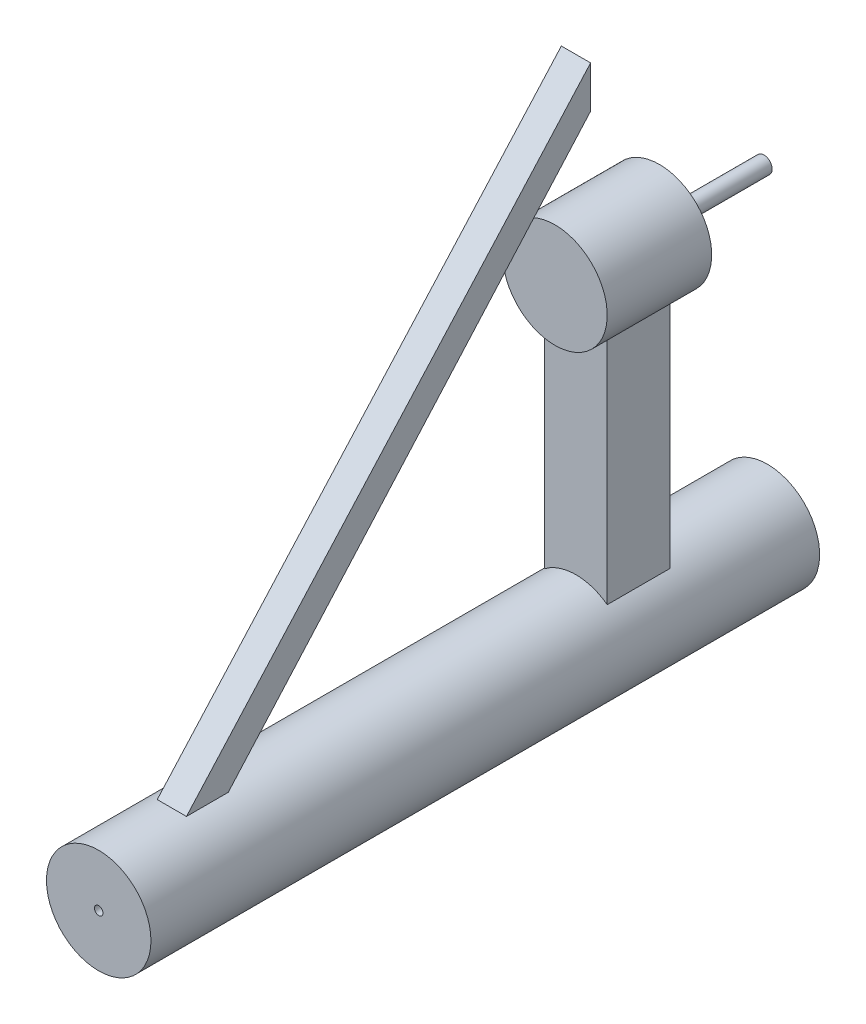
from build123d import *

# Parameters (mm, degrees)
CROQUIS1_R                    = 25
SALIENTE_EXTRUIR1_DEPTH       = 270
CROQUIS2_W                    = 30
CROQUIS2_H                    = 30
SALIENTE_EXTRUIR13_DEPTH      = 150
SALIENTE_EXTRUIR14_DEPTH      = 10
SALIENTE_EXTRUIR14_DEPTH_BACK = 40
CROQUIS14_R                   = 25
SALIENTE_EXTRUIR15_DEPTH      = 7
SALIENTE_EXTRUIR15_DEPTH_BACK = 7
SALIENTE_EXTRUIR16_START      = 50
CROQUIS17_R                   = 25
SALIENTE_EXTRUIR16_DEPTH      = 50
CROQUIS19_R                   = 3.95
SALIENTE_EXTRUIR17_DEPTH      = 50
CROQUIS20_R                   = 3.95
SALIENTE_EXTRUIR18_DEPTH      = 6
CROQUIS21_R                   = 2.05
CORTAR_EXTRUIR2_DEPTH         = 10
CROQUIS22_W                   = 20
CROQUIS22_H                   = 20
CORTAR_EXTRUIR3_DEPTH         = 20


with BuildPart() as part:
    # Croquis1 → Saliente-Extruir1 (new body)
    with BuildSketch(Plane.XY):
        Circle(CROQUIS1_R)
    extrude(amount=SALIENTE_EXTRUIR1_DEPTH)

    # Croquis2 → Saliente-Extruir13 (add)
    with BuildSketch(Plane(origin=(0, 0, 0), x_dir=(1, 0, 0), z_dir=(0, 1, 0))):
        with Locations((-0.05, -26.604607898)):
            Rectangle(CROQUIS2_W, CROQUIS2_H)
    extrude(amount=SALIENTE_EXTRUIR13_DEPTH)

    # Croquis14 → Saliente-Extruir14 (add, two sides: drawn at the far end of the back side and taken through both)
    with BuildSketch(Plane(origin=(0, 0, 11.604607898), x_dir=(-1, 0, 0), z_dir=(0, 0, -1)).offset(-SALIENTE_EXTRUIR14_DEPTH_BACK)):
        with Locations((0.05, 150)):
            Circle(CROQUIS14_R)
    extrude(amount=SALIENTE_EXTRUIR14_DEPTH + SALIENTE_EXTRUIR14_DEPTH_BACK)

    # Croquis17 → Saliente-Extruir16 (add)
    with BuildSketch(Plane(origin=(0, 0, 0), x_dir=(-1, 0, 0), z_dir=(0, 0, -1)).offset(SALIENTE_EXTRUIR16_START)):
        Circle(CROQUIS17_R)
    extrude(amount=-SALIENTE_EXTRUIR16_DEPTH)

    # Croquis19 → Saliente-Extruir17 (add)
    with BuildSketch(Plane(origin=(0, 0, 1.604607898), x_dir=(-1, 0, 0), z_dir=(0, 0, -1))):
        with Locations((0.05, 150)):
            Circle(CROQUIS19_R)
    extrude(amount=SALIENTE_EXTRUIR17_DEPTH)

    # Croquis20 → Saliente-Extruir18 (add)
    with BuildSketch(Plane(origin=(0, 0, -50), x_dir=(-1, 0, 0), z_dir=(0, 0, -1))):
        Circle(CROQUIS20_R)
    extrude(amount=SALIENTE_EXTRUIR18_DEPTH)

    # Croquis21 → Cortar-Extruir2 (cut)
    with BuildSketch(Plane.XY.offset(270)):
        Circle(CROQUIS21_R)
    extrude(amount=-CORTAR_EXTRUIR2_DEPTH, mode=Mode.SUBTRACT)

    # Croquis22 → Cortar-Extruir3 (cut)
    with BuildSketch(Plane(origin=(0, -25, 0), x_dir=(-1, 0, 0), z_dir=(0, -1, 0))):
        with Locations((0, 24.197696051)):
            Rectangle(CROQUIS22_W, CROQUIS22_H)
    extrude(amount=-CORTAR_EXTRUIR3_DEPTH, mode=Mode.SUBTRACT)


with BuildPart() as body_2:
    # Croquis15 → Saliente-Extruir15 (new, two sides: drawn at the far end of the back side and taken through both)
    with BuildSketch(Plane(origin=(0, 0, 0), x_dir=(0, 0, -1), z_dir=(1, 0, 0)).offset(-SALIENTE_EXTRUIR15_DEPTH_BACK)):
        Polygon((-41.604607898, 240.604607898), (-235, 25), (-215, 25), (-41.604607898, 220.604607898), align=None)
    extrude(amount=SALIENTE_EXTRUIR15_DEPTH + SALIENTE_EXTRUIR15_DEPTH_BACK)


solid = Compound([part.part, body_2.part])
